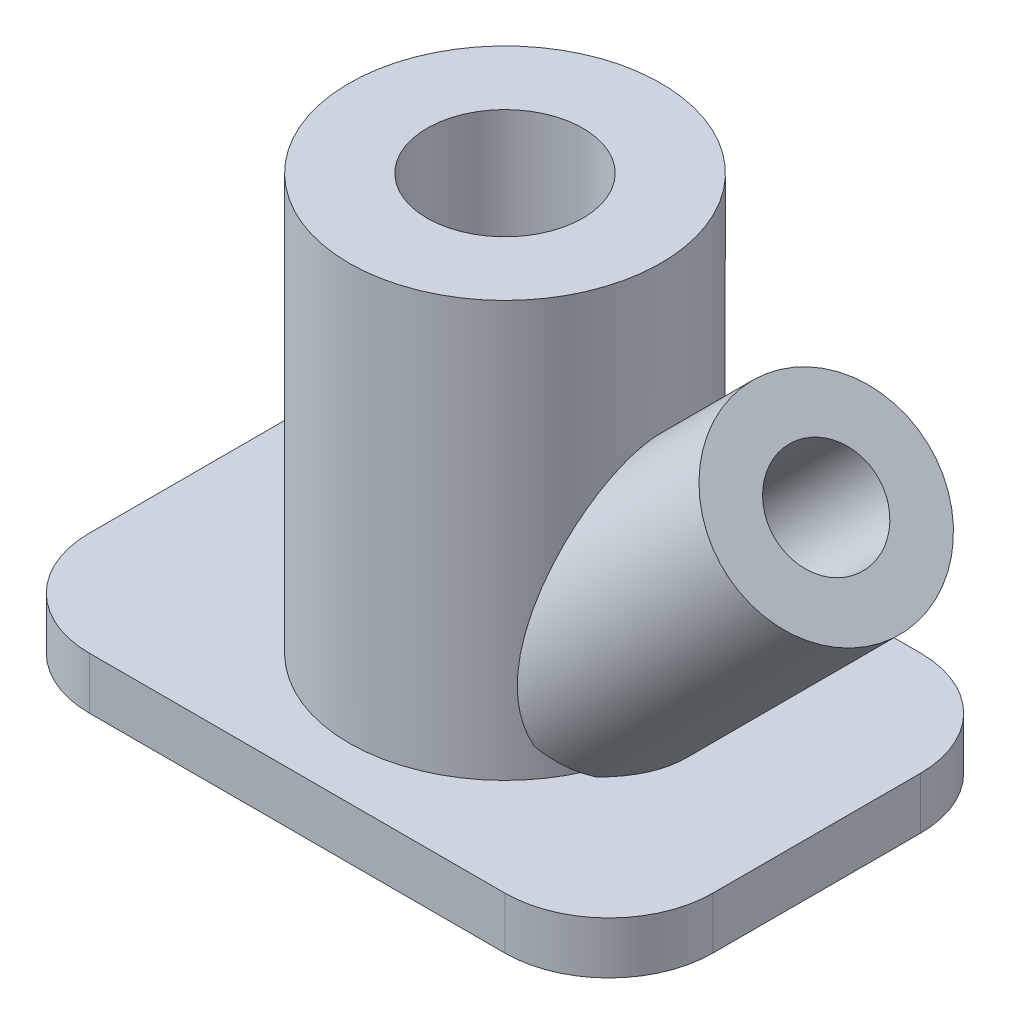
from build123d import *

# Parameters (mm, degrees)
CROQUIS1_W                 = 120
CROQUIS1_H                 = 80
SALIENTE_EXTRUIR1_DEPTH    = 10
REDONDEO1_R                = 20
CROQUIS2_R                 = 30
SALIENTE_EXTRUIR2_DEPTH    = 90
CROQUIS3_R                 = 15
CORTAR_EXTRUIR1_DEPTH      = 90
CROQUIS6_R                 = 20
SALIENTE_EXTRUIR3_DEPTH    = 62
CROQUIS7_R                 = 10
CORTAR_EXTRUIR3_DEPTH      = 62
CORTAR_EXTRUIR5_DEPTH      = 90
CORTAR_EXTRUIR5_DEPTH_BACK = 67
CROQUIS8_R                 = 15
CROQUIS9_R                 = 10
CORTAR_EXTRUIR7_DEPTH      = 80


with BuildPart() as part:
    # Croquis1 → Saliente-Extruir1 (new body)
    with BuildSketch(Plane(origin=(0, 0, 0), x_dir=(1, 0, 0), z_dir=(0, 1, 0))):
        Rectangle(CROQUIS1_W, CROQUIS1_H)
    extrude(amount=SALIENTE_EXTRUIR1_DEPTH)

    # Redondeo1
    redondeo1_edges = [part.edges().sort_by_distance(p)[0] for p in [
        (60, 5, 40),
        (-60, 5, 40),
        (-60, 5, -40),
        (60, 5, -40),
    ]]
    fillet(redondeo1_edges, radius=REDONDEO1_R)

    # Croquis2 → Saliente-Extruir2 (add)
    with BuildSketch(Plane(origin=(0, 0, 0), x_dir=(1, 0, 0), z_dir=(0, 1, 0))):
        with Locations(Location((0, 0, 0), (0, 0, 90))):
            Circle(CROQUIS2_R)
    extrude(amount=SALIENTE_EXTRUIR2_DEPTH)

    # Croquis3 → Cortar-Extruir1 (cut)
    with BuildSketch(Plane(origin=(0, 90, 0), x_dir=(1, 0, 0), z_dir=(0, 1, 0))):
        with Locations(Location((0, 0, 0), (0, 0, 270))):
            Circle(CROQUIS3_R)
    extrude(amount=-CORTAR_EXTRUIR1_DEPTH, mode=Mode.SUBTRACT)

    # Croquis6 → Saliente-Extruir3 (add)
    with BuildSketch(Plane(origin=(63.509962174, 63.509962174, 0), x_dir=(0, 0, -1), z_dir=(0.7071067811865487, 0.7071067811865465, 0))):
        with Locations(Location((0, 2.390242981, 0), (0, 0, 90))):
            Circle(CROQUIS6_R)
    extrude(amount=-SALIENTE_EXTRUIR3_DEPTH)

    # Croquis7 → Cortar-Extruir3 (cut)
    with BuildSketch(Plane(origin=(63.509962174, 63.509962174, 0), x_dir=(0, 0, -1), z_dir=(0.7071067811865486, 0.7071067811865465, 0))):
        with Locations(Location((0, 2.390242981, 0), (0, 0, 90))):
            Circle(CROQUIS7_R)
    extrude(amount=-CORTAR_EXTRUIR3_DEPTH, mode=Mode.SUBTRACT)

    # Croquis8 → Cortar-Extruir5 (cut, two sides: drawn at the far end of the back side and taken through both)
    with BuildSketch(Plane(origin=(0, 0, 0), x_dir=(1, 0, 0), z_dir=(0, 1, 0)).offset(-CORTAR_EXTRUIR5_DEPTH_BACK)):
        with Locations(Location((0, 0, 0), (0, 0, 270))):
            Circle(CROQUIS8_R)
    extrude(amount=CORTAR_EXTRUIR5_DEPTH + CORTAR_EXTRUIR5_DEPTH_BACK, mode=Mode.SUBTRACT)

    # Croquis9 → Cortar-Extruir7 (cut)
    with BuildSketch(Plane(origin=(63.509962174, 63.509962174, 0), x_dir=(0, 0, -1), z_dir=(0.7071067811865487, 0.7071067811865465, 0))):
        with Locations(Location((0, 2.390242981, 0), (0, 0, 90))):
            Circle(CROQUIS9_R)
    extrude(amount=-CORTAR_EXTRUIR7_DEPTH, mode=Mode.SUBTRACT)


solid = part.part
